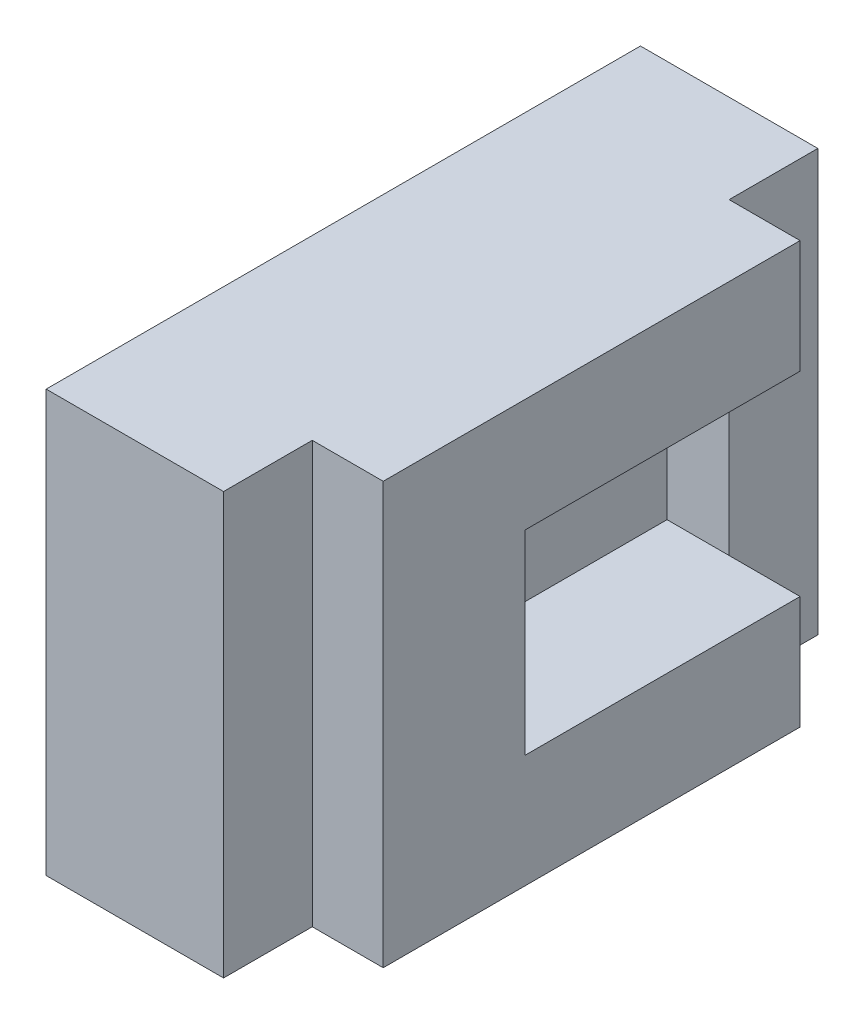
from build123d import *

# Parameters (mm, degrees)
SKETCH1_W           = 67
SKETCH1_H           = 47.5
BOSS_EXTRUDE1_DEPTH = 28
SKETCH2_W           = 31
SKETCH2_H           = 22
CUT_EXTRUDE1_DEPTH  = 15
SKETCH3_W           = 10
SKETCH3_H           = 47.5
CUT_EXTRUDE2_DEPTH  = 8


with BuildPart() as part:
    # Sketch1 → Boss-Extrude1 (new body)
    with BuildSketch(Plane(origin=(0, 0, 0), x_dir=(0, 0, -1), z_dir=(1, 0, 0))):
        with Locations((33.5, -23.75)):
            Rectangle(SKETCH1_W, SKETCH1_H)
    extrude(amount=BOSS_EXTRUDE1_DEPTH)

    # Sketch2 → Cut-Extrude1 (cut)
    with BuildSketch(Plane(origin=(28, 0, 0), x_dir=(0, 0, -1), z_dir=(1, 0, 0))):
        with Locations((41.5, -23.75)):
            Rectangle(SKETCH2_W, SKETCH2_H)
    extrude(amount=-CUT_EXTRUDE1_DEPTH, mode=Mode.SUBTRACT)

    # Sketch3 → Cut-Extrude2 (cut)
    with BuildSketch(Plane(origin=(28, 0, 0), x_dir=(0, 0, -1), z_dir=(1, 0, 0))):
        with Locations((5, -23.75)):
            Rectangle(SKETCH3_W, SKETCH3_H)
        with Locations((62, -23.75)):
            Rectangle(SKETCH3_W, SKETCH3_H)
    extrude(amount=-CUT_EXTRUDE2_DEPTH, mode=Mode.SUBTRACT)


solid = part.part
